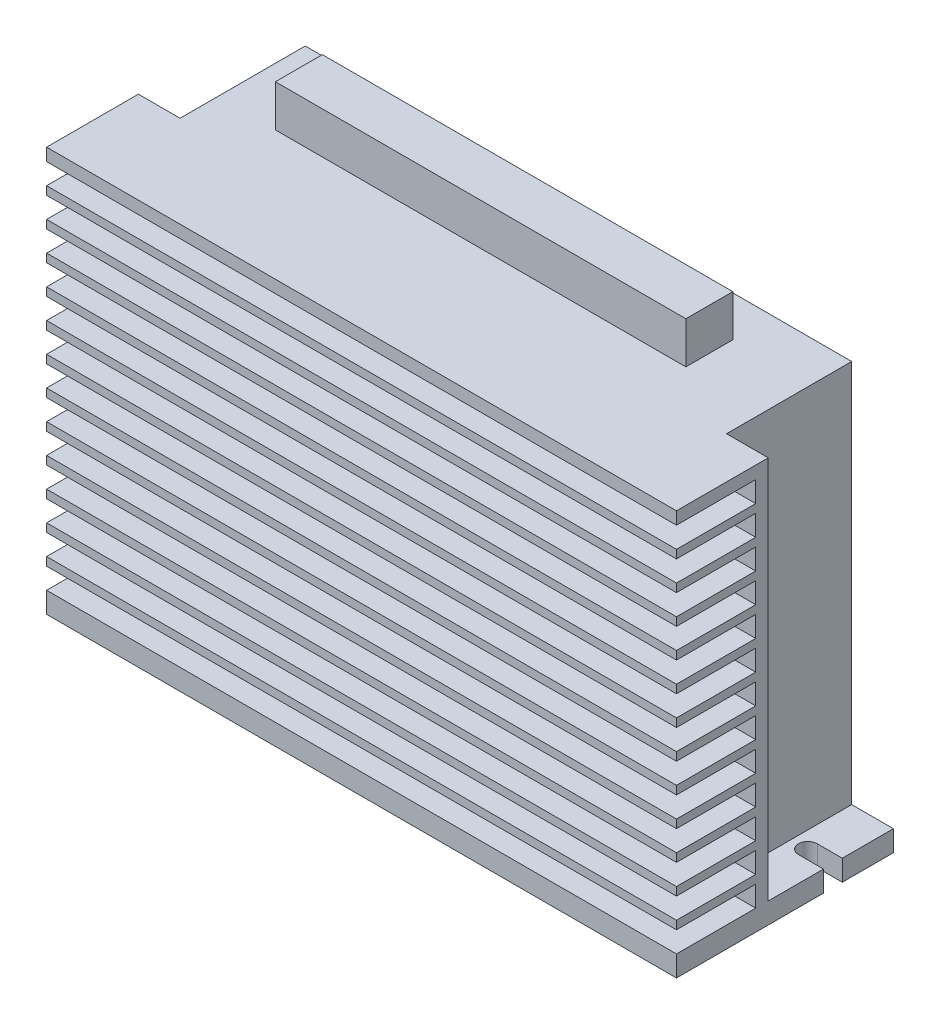
from build123d import *

# Parameters (mm, degrees)
BOSS_EXTRUDE1_DEPTH            = 92
BOSS_EXTRUDE1_DEPTH_BACK       = 5
SKETCH1_W                      = 151
SKETCH1_H                      = 52
CUT_EXTRUDE1_REACH             = 123.821
SKETCH2_W                      = 10
SKETCH2_H                      = 30
CUT_EXTRUDE2_REACH             = 123.821
CUT_EXTRUDE3_REACH             = 123.821
SKETCH4_W                      = 19
SKETCH4_H                      = 5
CUT_EXTRUDE3_DIRECTION_2_REACH = 123.821
LPATTERN1_COUNT                = 13
LPATTERN1_PITCH                = 7
SKETCH5_W                      = 98.406366265
SKETCH5_H                      = 11.254687051
BOSS_EXTRUDE2_DEPTH            = 10


with BuildPart() as part:
    # Sketch1 → Boss-Extrude1 (new, two sides: drawn at the far end of the back side and taken through both)
    with BuildSketch(Plane(origin=(0, 0, 0), x_dir=(1, 0, 0), z_dir=(0, 1, 0)).offset(-BOSS_EXTRUDE1_DEPTH_BACK)):
        Rectangle(SKETCH1_W, SKETCH1_H)
    extrude(amount=BOSS_EXTRUDE1_DEPTH + BOSS_EXTRUDE1_DEPTH_BACK)

    # Sketch2 → Cut-Extrude1 (cut, up to next)
    with BuildSketch(Plane(origin=(0, 0, 0), x_dir=(1, 0, 0), z_dir=(0, 1, 0)), mode=Mode.PRIVATE) as cut_extrude1_sk1:
        with Locations((-70.5, 11)):
            Rectangle(SKETCH2_W, SKETCH2_H)
    cut_extrude1_tool1 = extrude(cut_extrude1_sk1.sketch, amount=CUT_EXTRUDE1_REACH, mode=Mode.PRIVATE) & part.part
    # Sketch2 → Cut-Extrude1 (cut, up to next)
    with BuildSketch(Plane(origin=(0, 0, 0), x_dir=(1, 0, 0), z_dir=(0, 1, 0)), mode=Mode.PRIVATE) as cut_extrude1_sk2:
        with Locations((70.5, 11)):
            Rectangle(SKETCH2_W, SKETCH2_H)
    cut_extrude1_tool2 = extrude(cut_extrude1_sk2.sketch, amount=CUT_EXTRUDE1_REACH, mode=Mode.PRIVATE) & part.part
    add(cut_extrude1_tool1.solids().sort_by_distance((-70.5, 0, -11))[0], mode=Mode.SUBTRACT)
    add(cut_extrude1_tool2.solids().sort_by_distance((70.5, 0, -11))[0], mode=Mode.SUBTRACT)

    # Sketch3 → Cut-Extrude2 (cut, up to next)
    with BuildSketch(Plane(origin=(0, 0, 0), x_dir=(1, 0, 0), z_dir=(0, 1, 0)), mode=Mode.PRIVATE) as cut_extrude2_sk1:
        with BuildLine():
            Line((-69.5, 9.25), (-75.5, 9.25))
            Line((-75.5, 9.25), (-75.5, 13.75))
            Line((-75.5, 13.75), (-69.5, 13.75))
            ThreePointArc((-69.5, 13.75), (-67.25, 11.5), (-69.5, 9.25))
        make_face()
    cut_extrude2_tool1 = extrude(cut_extrude2_sk1.sketch, amount=-CUT_EXTRUDE2_REACH, mode=Mode.PRIVATE) & part.part
    cut_extrude2 = cut_extrude2_tool1.solids().sort_by_distance((-71.600192, 0, -11.5))[0]
    add(cut_extrude2, mode=Mode.SUBTRACT)

    # Mirror1: Cut-Extrude2 across plane
    add(cut_extrude2.mirror(Plane(origin=(0, 0, 0), x_dir=(0, 0, 1), z_dir=(1, 0, 0))), mode=Mode.SUBTRACT)

    # Sketch4 → Cut-Extrude3 (cut, up to next)
    with BuildSketch(Plane(origin=(0, 0, 0), x_dir=(0, 0, -1), z_dir=(1, 0, 0)), mode=Mode.PRIVATE) as cut_extrude3_sk1:
        with Locations((-16.5, 2.5)):
            Rectangle(SKETCH4_W, SKETCH4_H)
    cut_extrude3_tool1 = extrude(cut_extrude3_sk1.sketch, amount=-CUT_EXTRUDE3_REACH, mode=Mode.PRIVATE) & part.part
    cut_extrude3 = cut_extrude3_tool1.solids().sort_by_distance((0, 2.5, 16.5))[0]
    add(cut_extrude3, mode=Mode.SUBTRACT)

    # Sketch4 → Cut-Extrude3 direction 2 (cut, up to next)
    with BuildSketch(Plane(origin=(0, 0, 0), x_dir=(0, 0, -1), z_dir=(1, 0, 0)), mode=Mode.PRIVATE) as cut_extrude3_direction_2_sk1:
        with Locations((-16.5, 2.5)):
            Rectangle(SKETCH4_W, SKETCH4_H)
    cut_extrude3_direction_2_tool1 = extrude(cut_extrude3_direction_2_sk1.sketch, amount=CUT_EXTRUDE3_DIRECTION_2_REACH, mode=Mode.PRIVATE) & part.part
    cut_extrude3_direction_2 = cut_extrude3_direction_2_tool1.solids().sort_by_distance((0, 2.5, 16.5))[0]
    add(cut_extrude3_direction_2, mode=Mode.SUBTRACT)

    # LPattern1: Cut-Extrude3, Cut-Extrude3 direction 2 ×13
    with Locations(*[(0, i * LPATTERN1_PITCH, 0) for i in range(1, LPATTERN1_COUNT)]):
        add(cut_extrude3, mode=Mode.SUBTRACT)
        add(cut_extrude3_direction_2, mode=Mode.SUBTRACT)

    # Sketch5 → Boss-Extrude2 (add)
    with BuildSketch(Plane(origin=(0, 92, 0), x_dir=(1, 0, 0), z_dir=(0, 1, 0))):
        with Locations((-2.452944614, 10.629426659)):
            Rectangle(SKETCH5_W, SKETCH5_H)
    extrude(amount=BOSS_EXTRUDE2_DEPTH)


solid = part.part
